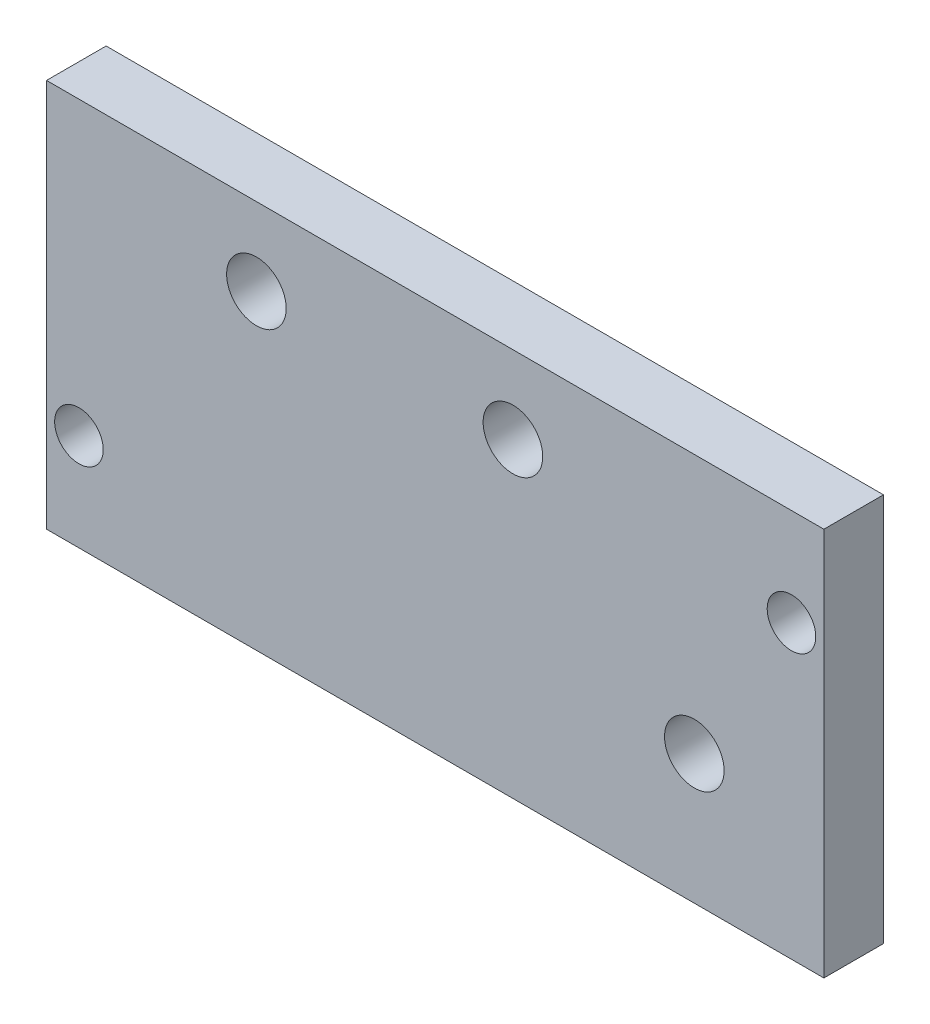
from build123d import *

# Parameters (mm, degrees)
SKETCH1_W                      = 60
SKETCH1_H                      = 30
SKETCH1_R                      = 2.3
BOSS_EXTRUDE1_DEPTH            = 4.6
CUT_EXTRUDE1_REACH             = 35.855
SKETCH2_R                      = 1.875
CUT_EXTRUDE1_DIRECTION_2_DEPTH = 34.854984862


with BuildPart() as part:
    # Sketch1 → Boss-Extrude1 (new body)
    with BuildSketch(Plane.XY):
        Rectangle(SKETCH1_W, SKETCH1_H)
        with Locations((-13.800714267, 9.000714267)):
            Circle(SKETCH1_R, mode=Mode.SUBTRACT)
        with Locations((5.999285733, 9.000714267)):
            Circle(SKETCH1_R, mode=Mode.SUBTRACT)
        with Locations((20, -5)):
            Circle(SKETCH1_R, mode=Mode.SUBTRACT)
    extrude(amount=BOSS_EXTRUDE1_DEPTH)

    # Sketch2 → Cut-Extrude1 (cut, up to next)
    with BuildSketch(Plane.XY.offset(4.6), mode=Mode.PRIVATE) as cut_extrude1_sk1:
        with Locations(Location((-27.5, -7.5, 0), (0, 0, 180))):
            Circle(SKETCH2_R)
    cut_extrude1_tool1 = extrude(cut_extrude1_sk1.sketch, amount=-CUT_EXTRUDE1_REACH, mode=Mode.PRIVATE) & part.part
    # Sketch2 → Cut-Extrude1 (cut, up to next)
    with BuildSketch(Plane.XY.offset(4.6), mode=Mode.PRIVATE) as cut_extrude1_sk2:
        with Locations(Location((27.5, 7.5, 0), (0, 0, 180))):
            Circle(SKETCH2_R)
    cut_extrude1_tool2 = extrude(cut_extrude1_sk2.sketch, amount=-CUT_EXTRUDE1_REACH, mode=Mode.PRIVATE) & part.part
    add(cut_extrude1_tool1.solids().sort_by_distance((-27.5, -7.5, 4.6))[0], mode=Mode.SUBTRACT)
    add(cut_extrude1_tool2.solids().sort_by_distance((27.5, 7.5, 4.6))[0], mode=Mode.SUBTRACT)

    # Sketch2 → Cut-Extrude1 direction 2 (cut)
    with BuildSketch(Plane.XY.offset(4.6)):
        with Locations(Location((-27.5, -7.5, 0), (0, 0, 180))):
            Circle(SKETCH2_R)
        with Locations(Location((27.5, 7.5, 0), (0, 0, 180))):
            Circle(SKETCH2_R)
    extrude(amount=CUT_EXTRUDE1_DIRECTION_2_DEPTH, mode=Mode.SUBTRACT)


solid = part.part
